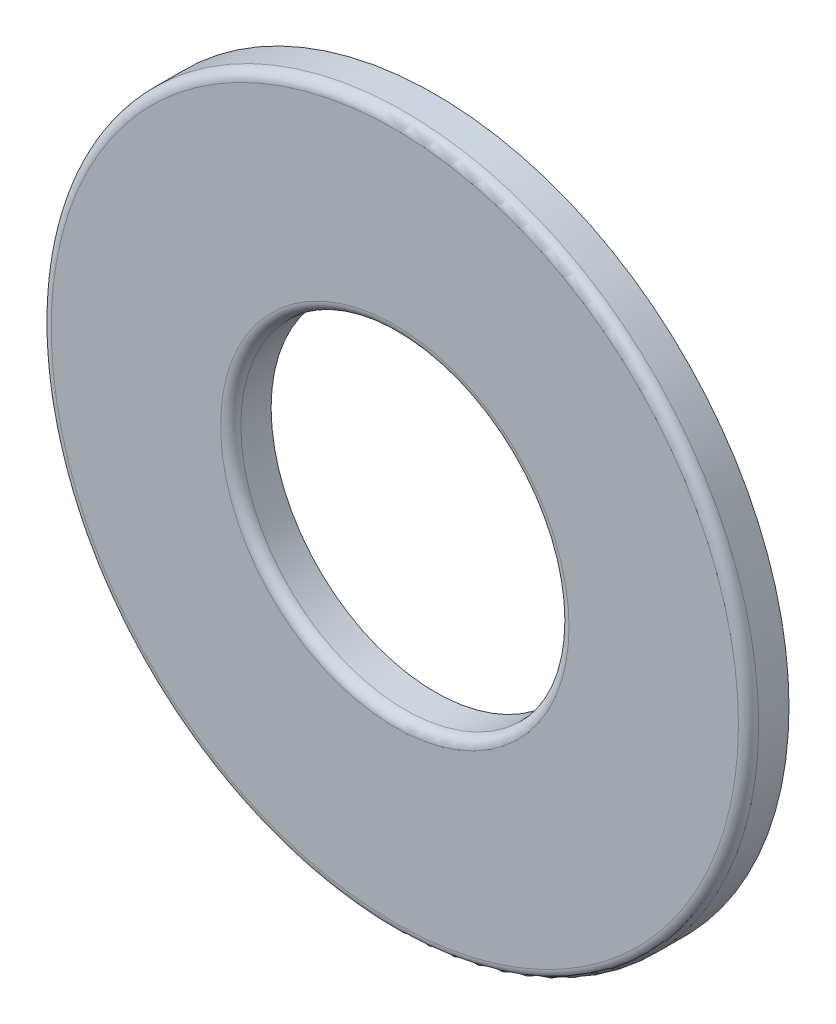
from build123d import *

# Parameters (mm, degrees)
BOSS_EXTRUDE1_DEPTH      = 0.635
BOSS_EXTRUDE1_DEPTH_BACK = 0.635
SKETCH3_R                = 11.1125
SKETCH3_R_2              = 5.1562
FILLET1_R                = 0.3175


with BuildPart() as part:
    # Sketch3 → Boss-Extrude1 (new, two sides: drawn at the far end of the back side and taken through both)
    with BuildSketch(Plane.XY.offset(-BOSS_EXTRUDE1_DEPTH_BACK)):
        Circle(SKETCH3_R)
        Circle(SKETCH3_R_2, mode=Mode.SUBTRACT)
    extrude(amount=BOSS_EXTRUDE1_DEPTH + BOSS_EXTRUDE1_DEPTH_BACK)

    # Fillet1
    fillet1_edges = [part.edges().sort_by_distance(p)[0] for p in [
        (-11.1125, 0, 0.635),
        (-5.1562, 0, 0.635),
    ]]
    fillet(fillet1_edges, radius=FILLET1_R)


solid = part.part
